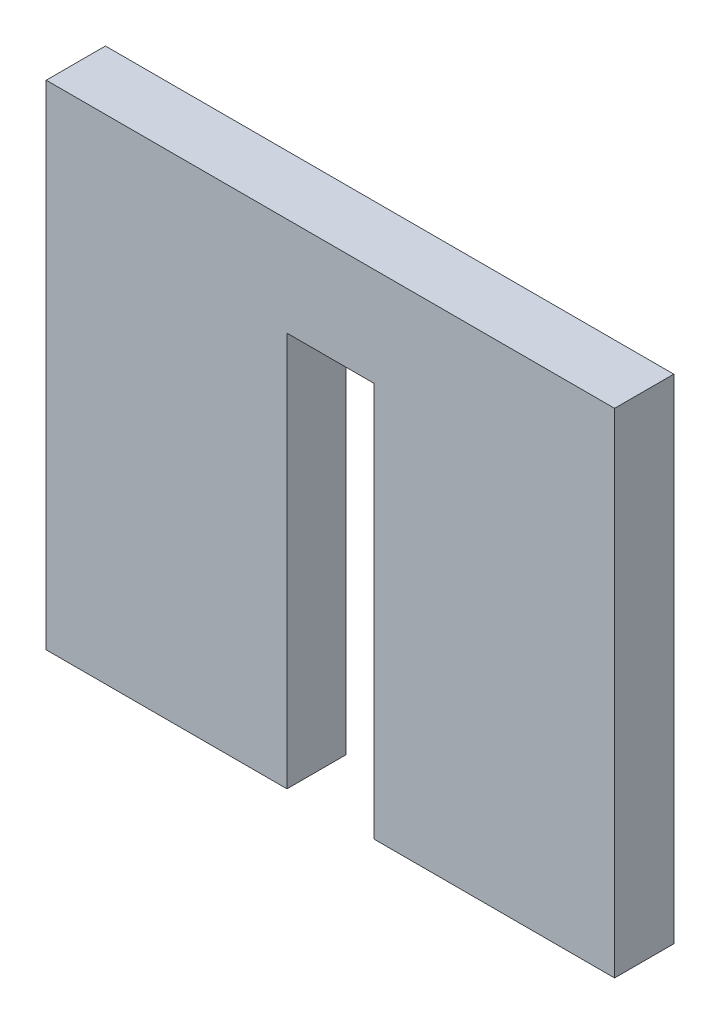
from build123d import *

# Parameters (mm, degrees)
BOSS_EXTRUDE1_DEPTH = 3


with BuildPart() as part:
    # Sketch1 → Boss-Extrude1 (new body)
    with BuildSketch(Plane.XY):
        Polygon((0, 0), (0, 25), (28.8, 25), (28.8, 0), (16.6, 0), (16.6, 20), (12.2, 20), (12.2, 0), align=None)
    extrude(amount=BOSS_EXTRUDE1_DEPTH)


solid = part.part
